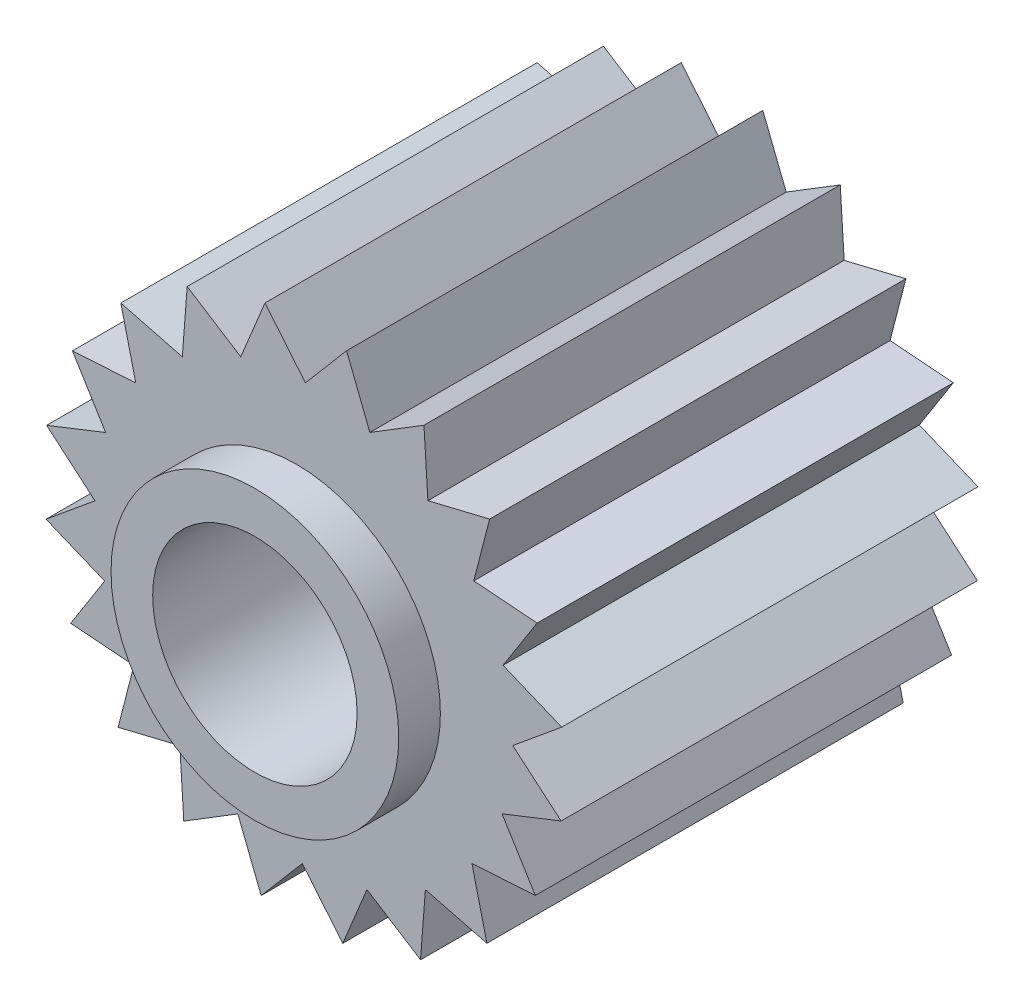
from build123d import *

# Parameters (mm, degrees)
SKETCH1_R           = 2.455762573
BOSS_EXTRUDE2_DEPTH = 10
SKETCH2_R           = 3.455762573
SKETCH2_R_2         = 2.455762573
BOSS_EXTRUDE3_DEPTH = 1


with BuildPart() as part:
    # Sketch1 → Boss-Extrude2 (new body)
    with BuildSketch(Plane.XY):
        Polygon((-1.339170865, 5.022694112), (-0.758059631, 6.433255275), (0.213267394, 5.256863813), (1.201824391, 6.418813952), (1.762086335, 4.999842629), (3.061322248, 5.799441968), (3.155676767, 4.276789583), (4.638413333, 4.635767768), (4.25762435, 3.158482146), (5.778720983, 3.041699891), (4.960062776, 1.75438804), (6.370623939, 1.173276806), (5.194232478, 0.20194978), (6.356182616, -0.786607217), (4.937211293, -1.346869161), (5.736810633, -2.646105074), (4.214158248, -2.740459593), (4.573136433, -4.223196159), (3.09585081, -3.842407175), (2.979068555, -5.363503808), (1.691756704, -4.544845601), (1.11064547, -5.955406764), (0.139318444, -4.779015303), (-0.849238553, -5.940965442), (-1.409500496, -4.521994119), (-2.708736409, -5.321593458), (-2.803090929, -3.798941073), (-4.285827494, -4.157919258), (-3.905038511, -2.680633635), (-5.426135144, -2.563851381), (-4.607476937, -1.27653953), (-6.0180381, -0.695428296), (-4.841646639, 0.27589873), (-6.003596778, 1.264455727), (-4.584625455, 1.824717671), (-5.384224794, 3.123953584), (-3.861572409, 3.218308103), (-4.220550594, 4.701044669), (-2.743264971, 4.320255686), (-2.626482716, 5.841352318), align=None)
        Circle(SKETCH1_R, mode=Mode.SUBTRACT)
    extrude(amount=BOSS_EXTRUDE2_DEPTH)

    # Sketch2 → Boss-Extrude3 (add)
    with BuildSketch(Plane.XY.offset(10)):
        with Locations(Location((0, 0, 0), (0, 0, 180))):
            Circle(SKETCH2_R)
        Circle(SKETCH2_R_2, mode=Mode.SUBTRACT)
    boss_extrude3 = extrude(amount=BOSS_EXTRUDE3_DEPTH)

    # Mirror1: Boss-Extrude3 across plane
    add(boss_extrude3.mirror(Plane.XY.offset(5)))


solid = part.part
